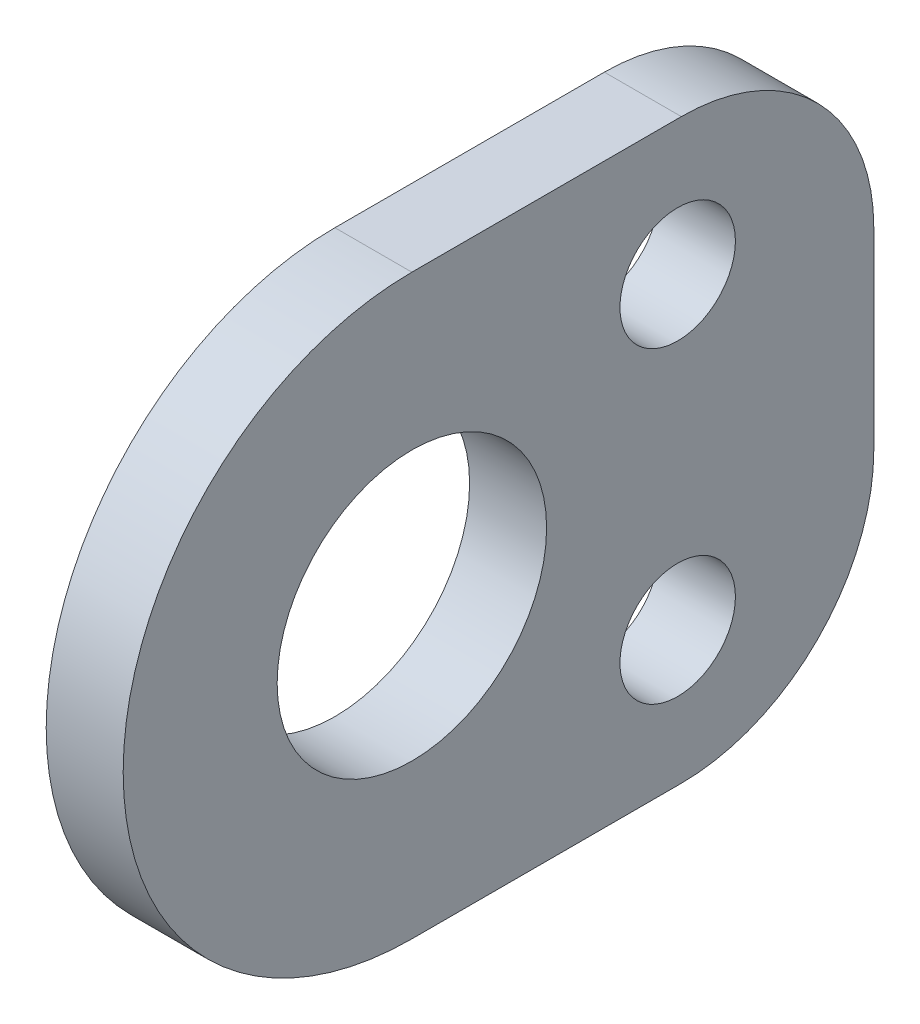
from build123d import *

# Parameters (mm, degrees)
SKETCH1_R           = 1.5
SKETCH1_R_2         = 3.5
BOSS_EXTRUDE1_DEPTH = 2
FILLET1_R           = 5


with BuildPart() as part:
    # Sketch1 → Boss-Extrude1 (new body)
    with BuildSketch(Plane(origin=(0, 0, 0), x_dir=(0, 0, -1), z_dir=(1, 0, 0))):
        with BuildLine():
            Line((0, 7.5), (12, 7.5))
            Line((12, 7.5), (12, -7.5))
            Line((12, -7.5), (0, -7.5))
            ThreePointArc((0, -7.5), (-7.5, 0), (0, 7.5))
        make_face()
        with Locations((6.905099565, -4)):
            Circle(SKETCH1_R, mode=Mode.SUBTRACT)
        with Locations((6.905099565, 4)):
            Circle(SKETCH1_R, mode=Mode.SUBTRACT)
        Circle(SKETCH1_R_2, mode=Mode.SUBTRACT)
    extrude(amount=BOSS_EXTRUDE1_DEPTH)

    # Fillet1
    fillet1_edges = [part.edges().sort_by_distance(p)[0] for p in [
        (1, 7.5, -12),
        (1, -7.5, -12),
    ]]
    fillet(fillet1_edges, radius=FILLET1_R)


solid = part.part
